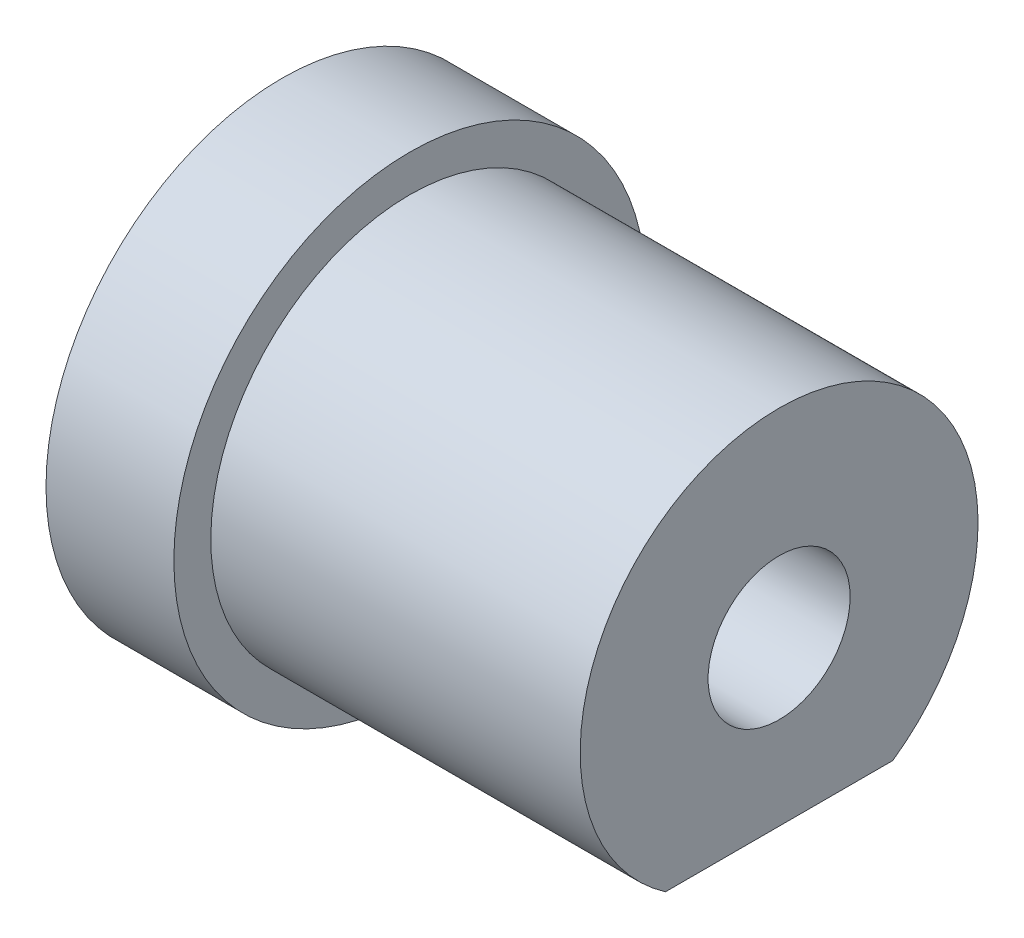
from build123d import *

# Parameters (mm, degrees)
SKETCH_1_R          = 8.3
EXTRUDE_1_DEPTH     = 4.5
SKETCH_2_R          = 6.1
CUT_EXTRUDE_1_DEPTH = 1.4
SKETCH_3_R          = 7
EXTRUDE_4_DEPTH     = 13
SKETCH_9_R          = 2.5
CUT_EXTRUDE_7_DEPTH = 22.072019362
CUT_EXTRUDE_START   = -13
CUT_EXTRUDE_8_DEPTH = 13
SKETCH_12_R         = 3.15
CUT_EXTRUDE_9_DEPTH = 7


with BuildPart() as part:
    # Эскиз1 → Бобышка-Вытянуть1 (new body)
    with BuildSketch(Plane(origin=(0, 0, 0), x_dir=(0, 0, -1), z_dir=(1, 0, 0))):
        Circle(SKETCH_1_R)
    extrude(amount=EXTRUDE_1_DEPTH)

    # Эскиз2 → Вырез-Вытянуть1 (cut)
    with BuildSketch(Plane.ZY):
        with Locations((-0.21618585, 0)):
            Circle(SKETCH_2_R)
    extrude(amount=-CUT_EXTRUDE_1_DEPTH, mode=Mode.SUBTRACT)

    # Эскиз3 → Бобышка-Вытянуть4 (add)
    with BuildSketch(Plane(origin=(4.5, 0, 0), x_dir=(0, 0, -1), z_dir=(1, 0, 0))):
        with Locations(Location((0, 0, 0), (0, 0, 180))):
            Circle(SKETCH_3_R)
    extrude(amount=EXTRUDE_4_DEPTH)

    # Эскиз9 → Вырез-Вытянуть7 (cut, through all)
    with BuildSketch(Plane(origin=(17.5, 0, 0), x_dir=(0, 0, -1), z_dir=(1, 0, 0))):
        Circle(SKETCH_9_R)
    extrude(amount=-CUT_EXTRUDE_7_DEPTH, mode=Mode.SUBTRACT)

    # Эскиз10 → Вырез-Вытянуть8 (cut)
    with BuildSketch(Plane(origin=(17.5, 0, 0), x_dir=(0, 0, -1), z_dir=(1, 0, 0)).offset(CUT_EXTRUDE_START)):
        with BuildLine():
            Line((-4, -5.744562647), (4, -5.744562647))
            ThreePointArc((4, -5.744562647), (0, -7), (-4, -5.744562647))
        make_face()
    extrude(amount=CUT_EXTRUDE_8_DEPTH, mode=Mode.SUBTRACT)

    # Эскиз12 → Вырез-Вытянуть9 (cut)
    with BuildSketch(Plane.ZY):
        Circle(SKETCH_12_R)
    extrude(amount=-CUT_EXTRUDE_9_DEPTH, mode=Mode.SUBTRACT)


solid = part.part
